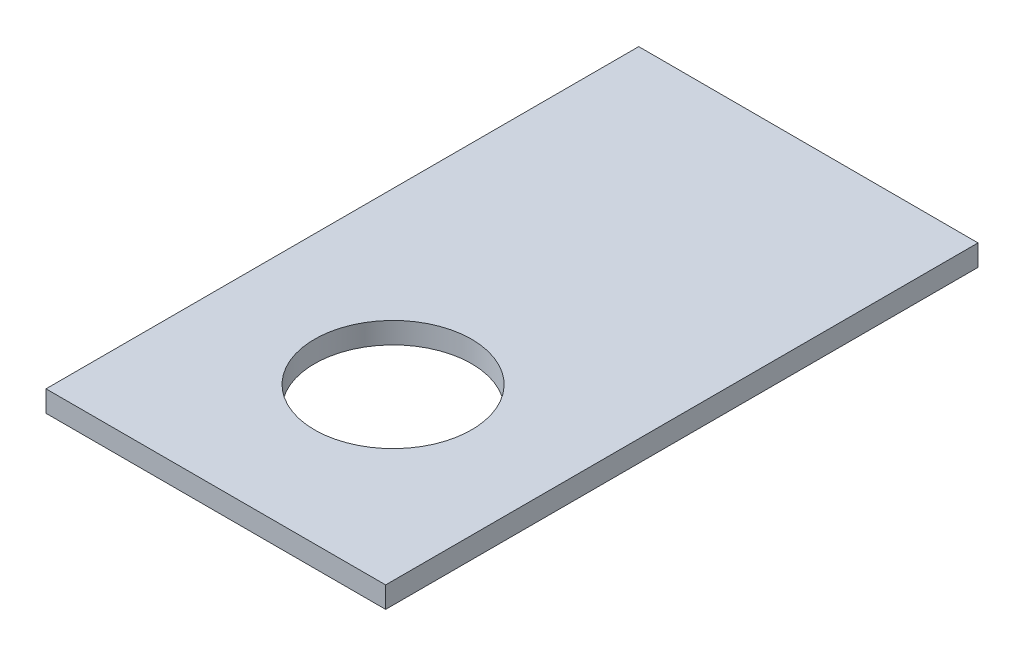
from build123d import *

# Parameters (mm, degrees)
SKETCH1_R               = 6
SKETCH1_R_2             = 1.525
BOSS_EXTRUDE1_DEPTH     = 5
CUT_EXTRUDE1_DEPTH      = 198.040604952
CUT_EXTRUDE1_DEPTH_BACK = 198.040604952
SKETCH2_R               = 18.5


with BuildPart() as part:
    # Sketch1 → Boss-Extrude1 (new body)
    with BuildSketch(Plane(origin=(0, 0, 0), x_dir=(1, 0, 0), z_dir=(0, 1, 0))):
        Polygon((0, -40.379460215), (80, -40.467284232), (80, -180), (0, -180), align=None)
        with Locations(Location((40, -131.25, 0), (0, 0, 270))):
            Circle(SKETCH1_R, mode=Mode.SUBTRACT)
        with Locations(Location((24.5, -138.25, 0), (0, 0, 270))):
            Circle(SKETCH1_R_2, mode=Mode.SUBTRACT)
        with Locations(Location((55.5, -138.25, 0), (0, 0, 270))):
            Circle(SKETCH1_R_2, mode=Mode.SUBTRACT)
        with Locations(Location((32.25, -124.826606241, 0), (0, 0, 270))):
            Circle(SKETCH1_R_2, mode=Mode.SUBTRACT)
        with Locations(Location((47.75, -124.826606241, 0), (0, 0, 270))):
            Circle(SKETCH1_R_2, mode=Mode.SUBTRACT)
    extrude(amount=BOSS_EXTRUDE1_DEPTH)

    # Sketch2 → Cut-Extrude1 (cut, two sides: drawn at the far end of the back side and taken through both)
    with BuildSketch(Plane(origin=(0, 5, 0), x_dir=(1, 0, 0), z_dir=(0, 1, 0)).offset(-CUT_EXTRUDE1_DEPTH_BACK)):
        with Locations(Location((40, -138.25, 0), (0, 0, 270))):
            Circle(SKETCH2_R)
    extrude(amount=CUT_EXTRUDE1_DEPTH + CUT_EXTRUDE1_DEPTH_BACK, mode=Mode.SUBTRACT)


solid = part.part
